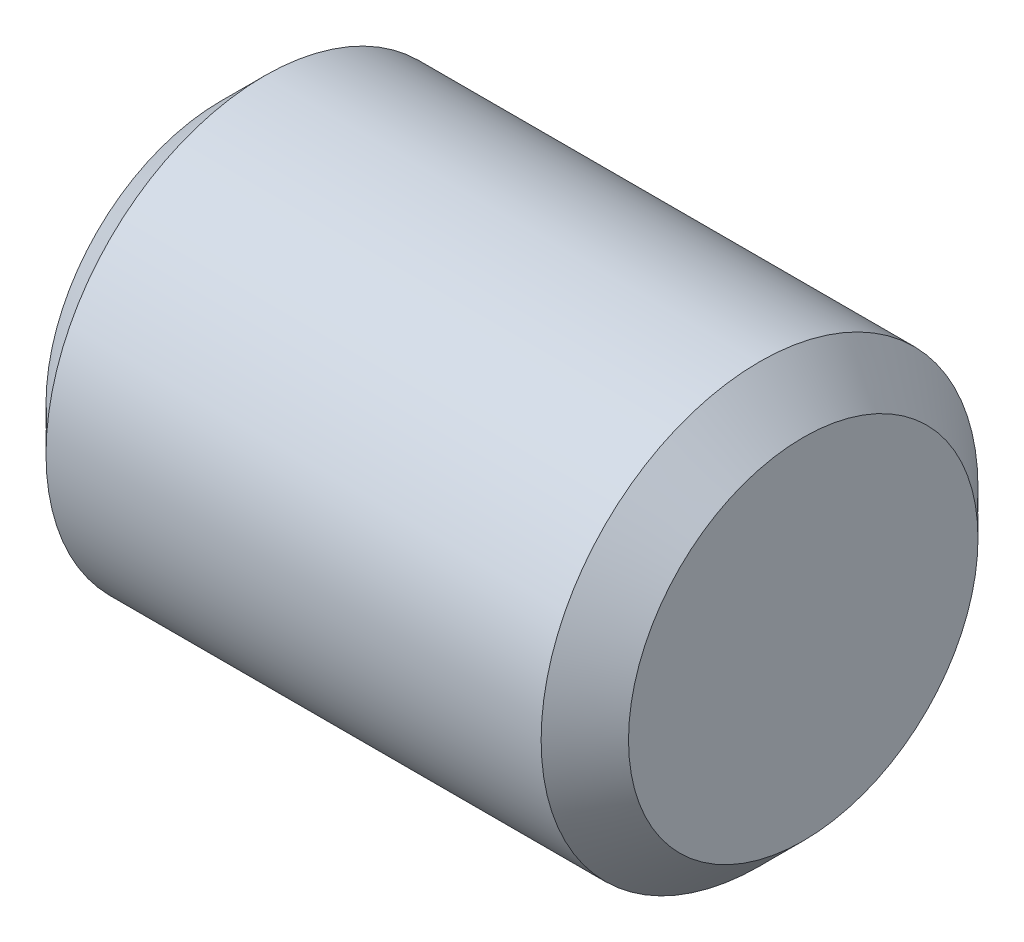
from build123d import *

# Parameters (mm, degrees)
EXTRUDE1_DEPTH      = 3.175
EXTRUDE1_DEPTH_BACK = 3.175
SKETCH2_R           = 2.38125
CHAMFER1_SIZE       = 0.47625


with BuildPart() as part:
    # Sketch2 → Extrude1 (new, two sides: drawn at the far end of the back side and taken through both)
    with BuildSketch(Plane(origin=(0, 0, 0), x_dir=(0, 0, -1), z_dir=(1, 0, 0)).offset(-EXTRUDE1_DEPTH_BACK)):
        Circle(SKETCH2_R)
    extrude(amount=EXTRUDE1_DEPTH + EXTRUDE1_DEPTH_BACK)

    # Chamfer1
    chamfer1_edges = [part.edges().sort_by_distance(p)[0] for p in [
        (-3.175, 0, 2.38125),
        (3.175, 0, 2.38125),
    ]]
    chamfer(chamfer1_edges, length=CHAMFER1_SIZE)


solid = part.part
